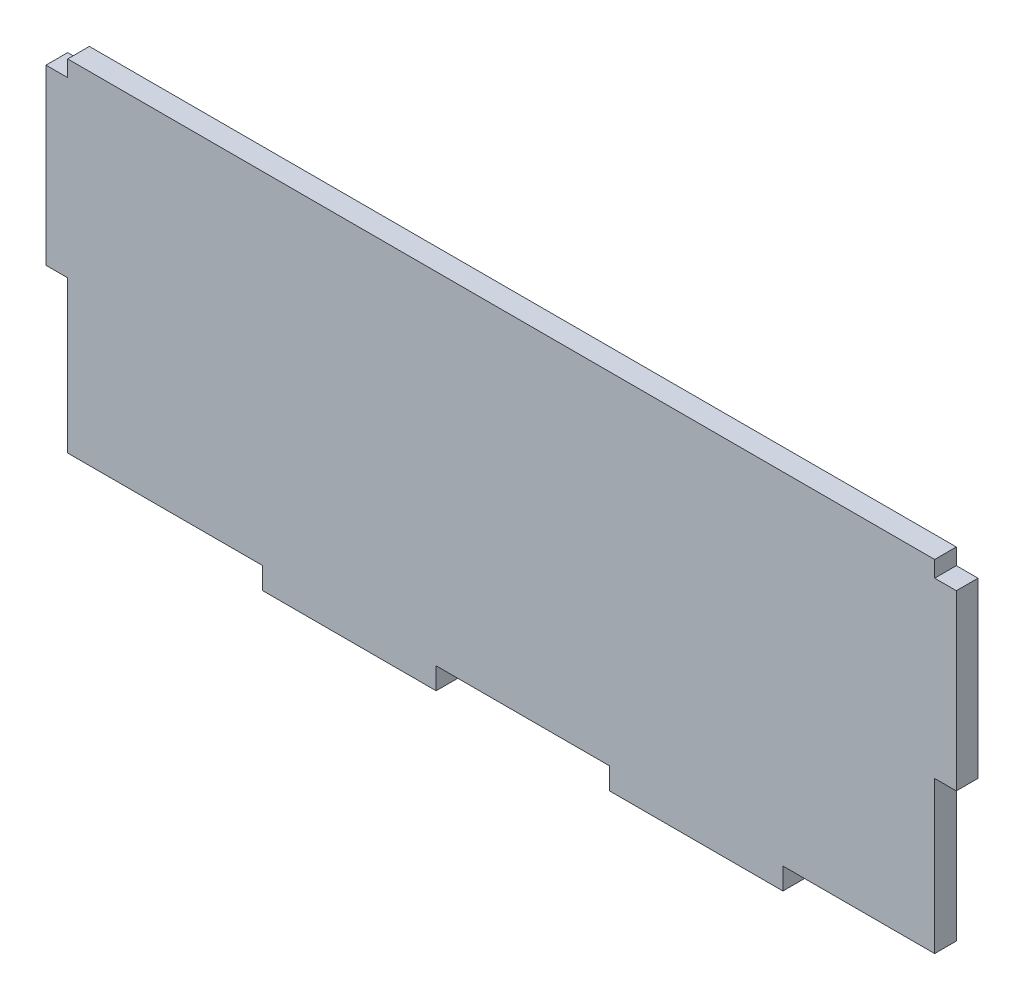
from build123d import *

# Parameters (mm, degrees)
BOSS_EXTRUDE1_DEPTH = 6.35


with BuildPart() as part:
    # Sketch1 → Boss-Extrude1 (new body)
    with BuildSketch(Plane.XY):
        Polygon((0, 0), (0, 44.45), (-6.35, 44.45), (-6.35, 95.25), (0, 95.25), (0, 100), (254, 100), (254, 95.25), (260.35, 95.25), (260.35, 44.45), (254, 44.45), (254, 0), (209.55, 0), (209.55, -6.35), (158.75, -6.35), (158.75, 0), (107.95, 0), (107.95, -6.35), (57.15, -6.35), (57.15, 0), align=None)
    extrude(amount=BOSS_EXTRUDE1_DEPTH)


solid = part.part
